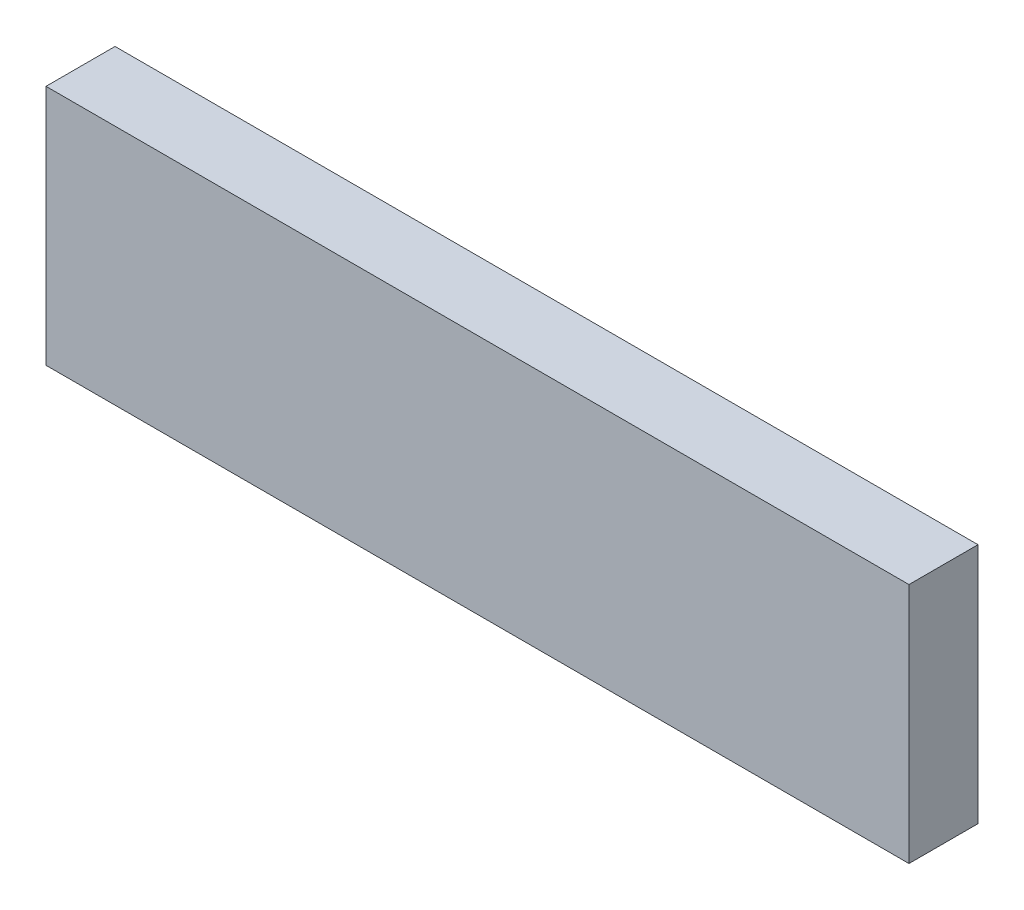
from build123d import *

# Parameters (mm, degrees)
SKETCH_1_W      = 250
SKETCH_1_H      = 70
EXTRUDE_1_DEPTH = 20


with BuildPart() as part:
    # 草图1 → 凸台-拉伸1 (new body)
    with BuildSketch(Plane.XY):
        Rectangle(SKETCH_1_W, SKETCH_1_H)
    extrude(amount=EXTRUDE_1_DEPTH)


solid = part.part
